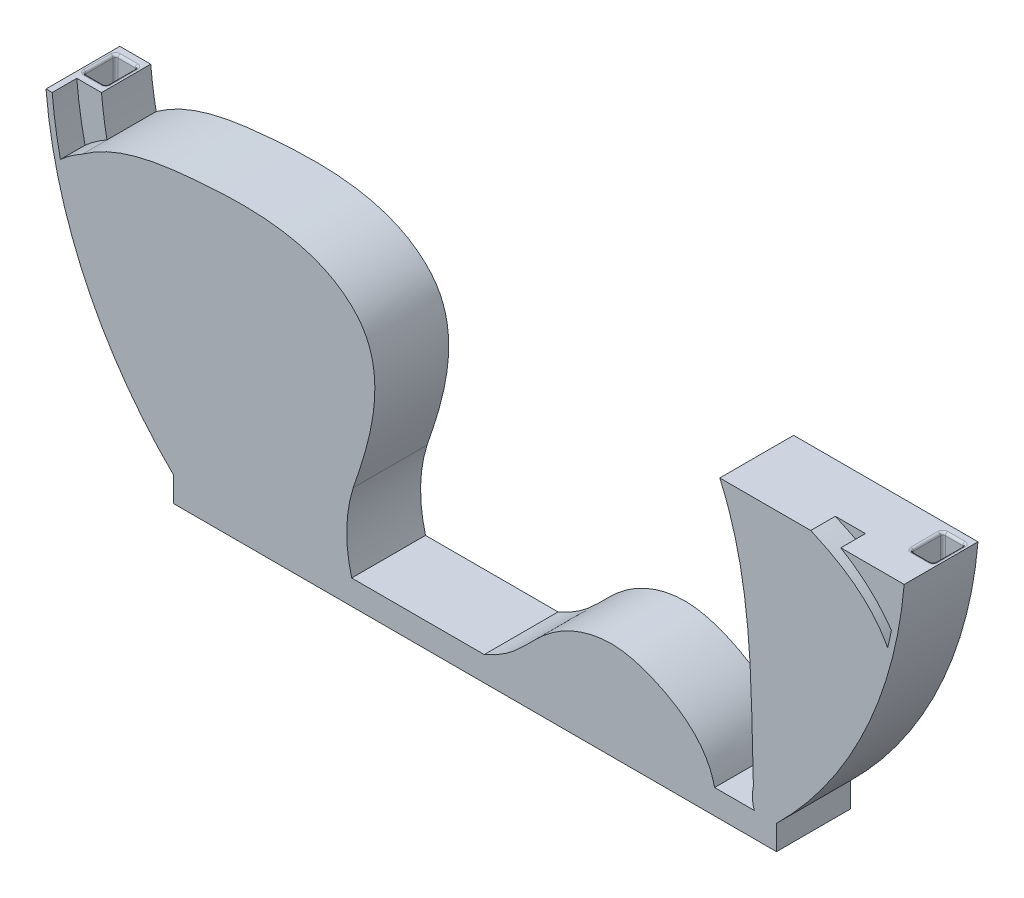
from build123d import *

# Parameters (mm, degrees)
SKETCH2_R           = 88.9
BOSS_EXTRUDE1_DEPTH = 7.62
CUT_EXTRUDE1_DEPTH  = 5.08
CUT_EXTRUDE2_DEPTH  = 5.08
SKETCH6_R           = 88.9
SKETCH6_R_2         = 87.63
BOSS_EXTRUDE2_DEPTH = 7.62
SKETCH5_W           = 447.85569709
SKETCH5_H           = 96.634651294
CUT_EXTRUDE3_DEPTH  = 132.443466321
CUT_EXTRUDE4_DEPTH  = 5.08
FILLET1_R           = 0.508
FILLET2_R           = 0.508
SKETCH8_W           = 235.469737428
SKETCH8_H           = 63.022782664
CUT_EXTRUDE6_DEPTH  = 30.48
SKETCH11_W          = 124.434078934
SKETCH11_H          = 15.24
BOSS_EXTRUDE3_DEPTH = 5.08
BOSS_EXTRUDE4_DEPTH = 5.08


with BuildPart() as part:
    # Sketch2 → Boss-Extrude1 (new, symmetric)
    with BuildSketch(Plane.XY):
        with Locations(Location((0, 0, 0), (0, 0, 180))):
            Circle(SKETCH2_R)
        with BuildLine():
            ThreePointArc((-82.315247566, -6.2211348), (-81.828164186, -10.892843798), (-81.076160162, -15.529286954))
            add(Edge.make_bspline(
                [(-81.076160162, -15.529286954), (-73.906972416, -10.329566502), (-59.046073895, -8.193381199), (-41.118812884, -7.621785306), (-29.401022662, -11.302114845), (-16.402067506, -22.130924736), (-22.534501322, -39.59705785), (-25.174662603, -47.236332112)],
                knots=[0, 0, 0, 0, 0.276571303, 0.483745751, 0.57530858, 0.672728071, 1, 1, 1, 1], degree=3))
            add(Edge.make_bspline(
                [(-25.174662603, -47.236332112), (-27.78260004, -55.688683624), (-25.255419914, -64.276124819)],
                knots=[0, 0, 0, 1, 1, 1], degree=2))
            add(Edge.make_bspline(
                [(-25.255419914, -64.276124819), (-19.568994185, -66.326395956), (-8.191864865, -67.179069199), (6.698062012, -62.452519029), (13.701149455, -53.656480208), (20.991800731, -49.374990358), (29.14906596, -47.7148715), (41.321609726, -51.605604), (49.118683791, -58.056687878), (49.804799161, -65.833004493)],
                knots=[0, 0, 0, 0, 0.203689327, 0.383928899, 0.501194003, 0.577509121, 0.667833303, 0.774874029, 1, 1, 1, 1], degree=3))
            ThreePointArc((49.804799161, -65.833004493), (53.727997634, -62.672200937), (57.451073953, -59.277960505))
            add(Edge.make_bspline(
                [(57.451073953, -59.277960505), (56.756918153, -39.692420945), (57.937164009, -17.253163459), (46.295557994, 0)],
                knots=[0, 0, 0, 0, 1, 1, 1, 1], degree=3))
            add(Edge.make_bspline(
                [(46.295557994, 0), (29.352418178, 2.160827537), (12.476860977, -1.829953153), (-4.097004325, -4.838743622)],
                knots=[0, 0, 0, 0, 1, 1, 1, 1], degree=3))
            add(Edge.make_bspline(
                [(-4.097004325, -4.838743622), (-9.003253572, -4.538646122), (-9.174496671, 2.827576235), (-6.823743398, 13.979544817), (0.460919685, 29.784330466), (13.972068662, 51.572454476), (27.394543454, 67.53561229), (37.735282985, 73.420371274)],
                knots=[0, 0, 0, 0, 0.104628163, 0.200082966, 0.362713634, 0.636377303, 1, 1, 1, 1], degree=3))
            ThreePointArc((37.735282985, 73.420371274), (31.253924322, 76.40480819), (24.539050502, 78.818383011))
            add(Edge.make_bspline(
                [(24.539050502, 78.818383011), (20.455603408, 74.411727836), (17.564971871, 65.824999318), (9.51286746, 57.448673309), (-6.264292968, 43.842012074), (-22.034432487, 67.881542589), (-34.946297284, 64.774058813)],
                knots=[0, 0, 0, 0, 0.241588619, 0.345090174, 0.475626468, 1, 1, 1, 1], degree=3))
            add(Edge.make_bspline(
                [(-34.946297284, 64.774058813), (-40.534107409, 56.654806295), (-49.826434679, 42.328020188), (-53.897482917, 22.922904088), (-55.122078377, 8.697330529), (-64.97763294, -2.490084084), (-73.627608697, -8.872135806), (-82.315247566, -6.2211348)],
                knots=[0, 0, 0, 0, 0.32342158, 0.539679085, 0.642017351, 0.776511597, 1, 1, 1, 1], degree=3))
        make_face(mode=Mode.SUBTRACT)
    extrude(amount=BOSS_EXTRUDE1_DEPTH, both=True)

    # Sketch3 → Cut-Extrude1 (cut)
    with BuildSketch(Plane.XY.offset(7.62)):
        with BuildLine():
            ThreePointArc((45.031224335, -76.651150251), (52.423489091, -71.798243652), (59.297063103, -66.23494778))
            add(Edge.make_bspline(
                [(57.451073953, -59.277960505), (56.590081261, -63.222807516), (59.297063103, -66.23494778)],
                knots=[0, 0, 0, 1, 1, 1], degree=2))
            ThreePointArc((57.451073953, -59.277960505), (53.727997634, -62.672200937), (49.804799161, -65.833004493))
            add(Edge.make_bspline(
                [(49.804799161, -65.833004493), (50.290836256, -72.182369469), (45.031224335, -76.651150251)],
                knots=[0, 0, 0, 1, 1, 1], degree=2))
        make_face()
        with BuildLine():
            ThreePointArc((-88.68252483, 6.214482268), (-88.635767577, -6.849139077), (-86.675026694, -19.764861438))
            add(Edge.make_bspline(
                [(-81.076160162, -15.529286954), (-84.185623479, -17.238401337), (-86.675026694, -19.764861438)],
                knots=[0, 0, 0, 1, 1, 1], degree=2))
            ThreePointArc((-81.076160162, -15.529286954), (-81.828164186, -10.892843798), (-82.315247566, -6.2211348))
            add(Edge.make_bspline(
                [(-82.315247566, -6.2211348), (-88.132024584, -1.499163565), (-88.68252483, 6.214482268)],
                knots=[0, 0, 0, 1, 1, 1], degree=2))
        make_face()
        with BuildLine():
            ThreePointArc((46.295557994, 75.894211308), (38.302929005, 80.22528049), (29.909783679, 83.717470341))
            add(Edge.make_bspline(
                [(24.539050502, 78.818383011), (26.687958515, 81.902861564), (29.909783679, 83.717470341)],
                knots=[0, 0, 0, 1, 1, 1], degree=2))
            ThreePointArc((24.539050502, 78.818383011), (31.253924322, 76.40480819), (37.735282985, 73.420371274))
            add(Edge.make_bspline(
                [(37.735282985, 73.420371274), (41.692258874, 75.781578849), (46.295557994, 75.894211308)],
                knots=[0, 0, 0, 1, 1, 1], degree=2))
        make_face()
    extrude(amount=-CUT_EXTRUDE1_DEPTH, mode=Mode.SUBTRACT)

    # Sketch4 → Cut-Extrude2 (cut)
    with BuildSketch(Plane.XY.offset(7.62)):
        with BuildLine():
            add(Edge.make_bspline(
                [(47.900635375, -2.546062133), (47.394653083, -1.68578683), (46.860186189, -0.836793698), (46.295557994, 0)],
                knots=[0.951499115, 0.951499115, 0.951499115, 0.951499115, 1, 1, 1, 1], degree=3))
            add(Edge.make_bspline(
                [(46.295557994, 0), (53.13831993, -0.121479856), (68.560923547, -2.55317749), (82.330777435, -11.060245422), (86.920742606, -18.654610819)],
                knots=[0, 0, 0, 0, 0.442007256, 1, 1, 1, 1], degree=3))
            ThreePointArc((86.920742606, -18.654610819), (86.48950366, -20.561511535), (86.016435709, -22.458468066))
            add(Edge.make_bspline(
                [(47.900635375, -2.546062133), (54.105200197, -2.383601891), (68.545991377, -6.411725997), (82.278778054, -13.661239618), (86.016435709, -22.458468066)],
                knots=[0, 0, 0, 0, 0.409341375, 1, 1, 1, 1], degree=3))
        make_face()
        with BuildLine():
            add(Edge.make_bspline(
                [(-25.255419914, -64.276124819), (-24.329796264, -64.609863365), (-23.39490974, -64.901263139), (-22.452232953, -65.15178529)],
                knots=[0, 0, 0, 0, 0.033156093, 0.033156093, 0.033156093, 0.033156093], degree=3))
            add(Edge.make_bspline(
                [(-22.452232953, -65.15178529), (-17.435167734, -76.286545317), (-6.016270367, -83.097855064), (4.238511489, -88.798902135)],
                knots=[0, 0, 0, 0, 1, 1, 1, 1], degree=3))
            ThreePointArc((4.238511489, -88.798902135), (2.435652007, -88.866628153), (0.631789417, -88.897754989))
            add(Edge.make_bspline(
                [(-25.255419914, -64.276124819), (-21.127783836, -75.858222766), (-10.467359196, -84.393639797), (0.631789417, -88.897754989)],
                knots=[0, 0, 0, 0, 1, 1, 1, 1], degree=3))
        make_face()
        with BuildLine():
            add(Edge.make_bspline(
                [(-34.946297284, 64.774058813), (-50.35182607, 67.382365169), (-64.84460315, 60.814368716)],
                knots=[0, 0, 0, 1, 1, 1], degree=2))
            ThreePointArc((-64.84460315, 60.814368716), (-66.672342804, 58.804835729), (-68.43783363, 56.740399435))
            add(Edge.make_bspline(
                [(-35.097283324, 62.444599517), (-52.424851341, 65.607841777), (-68.43783363, 56.740399435)],
                knots=[0, 0, 0, 1, 1, 1], degree=2))
            Line((-35.097283324, 62.444599517), (-34.946297284, 64.774058813))
        make_face()
    extrude(amount=-CUT_EXTRUDE2_DEPTH, mode=Mode.SUBTRACT)

    # Sketch6 → Boss-Extrude2 (add, symmetric)
    with BuildSketch(Plane.XY):
        with Locations(Location((0, 0, 0), (0, 0, 180))):
            Circle(SKETCH6_R)
        Circle(SKETCH6_R_2, mode=Mode.SUBTRACT)
    extrude(amount=BOSS_EXTRUDE2_DEPTH, both=True)

    # Sketch5 → Cut-Extrude3 (cut, through all)
    with BuildSketch(Plane(origin=(0, -7.62, 0), x_dir=(1, 0, 0), z_dir=(0, 1, 0))):
        Rectangle(SKETCH5_W, SKETCH5_H)
    extrude(amount=CUT_EXTRUDE3_DEPTH, mode=Mode.SUBTRACT)

    # Sketch7 → Cut-Extrude4 (cut)
    with BuildSketch(Plane(origin=(0, -7.62, 0), x_dir=(1, 0, 0), z_dir=(0, 1, 0))):
        with BuildLine():
            Line((-87.163190925, 5.842), (-83.607190925, 5.842))
            ThreePointArc((-83.607190925, 5.842), (-83.24798068, 5.693210245), (-83.099190925, 5.334))
            Line((-83.099190925, 5.334), (-83.099190925, -0.254))
            ThreePointArc((-83.099190925, -0.254), (-83.24798068, -0.613210245), (-83.607190925, -0.762))
            Line((-83.607190925, -0.762), (-87.163190925, -0.762))
            ThreePointArc((-87.163190925, -0.762), (-87.522401169, -0.613210245), (-87.671190925, -0.254))
            Line((-87.671190925, -0.254), (-87.671190925, 5.334))
            ThreePointArc((-87.671190925, 5.334), (-87.522401169, 5.693210245), (-87.163190925, 5.842))
        make_face()
        with BuildLine():
            Line((87.163190925, -0.762), (83.607190925, -0.762))
            ThreePointArc((83.607190925, -0.762), (83.24798068, -0.613210245), (83.099190925, -0.254))
            Line((83.099190925, -0.254), (83.099190925, 5.334))
            ThreePointArc((83.099190925, 5.334), (83.24798068, 5.693210245), (83.607190925, 5.842))
            Line((83.607190925, 5.842), (87.163190925, 5.842))
            ThreePointArc((87.163190925, 5.842), (87.522401169, 5.693210245), (87.671190925, 5.334))
            Line((87.671190925, 5.334), (87.671190925, -0.254))
            ThreePointArc((87.671190925, -0.254), (87.522401169, -0.613210245), (87.163190925, -0.762))
        make_face()
    extrude(amount=-CUT_EXTRUDE4_DEPTH, mode=Mode.SUBTRACT)

    # Fillet1
    fillet1_edges = [part.edges().sort_by_distance(p)[0] for p in [
        (-87.522401169, -7.62, 0.613210245),
        (-85.385190925, -7.62, 0.762),
        (-83.24798068, -7.62, 0.613210245),
        (-83.099190925, -7.62, -2.54),
        (-83.24798068, -7.62, -5.693210245),
        (-85.385190925, -7.62, -5.842),
        (-87.522401169, -7.62, -5.693210245),
        (-87.671190925, -7.62, -2.54),
    ]]
    fillet(fillet1_edges, radius=FILLET1_R)

    # Fillet2
    fillet2_edges = [part.edges().sort_by_distance(p)[0] for p in [
        (87.522401169, -7.62, 0.613210245),
        (87.671190925, -7.62, -2.54),
        (87.522401169, -7.62, -5.693210245),
        (85.385190925, -7.62, -5.842),
        (83.24798068, -7.62, -5.693210245),
        (83.099190925, -7.62, -2.54),
        (83.24798068, -7.62, 0.613210245),
        (85.385190925, -7.62, 0.762),
    ]]
    fillet(fillet2_edges, radius=FILLET2_R)

    # Sketch8 → Cut-Extrude6 (cut)
    with BuildSketch(Plane(origin=(0, -63.5, 0), x_dir=(-1, 0, 0), z_dir=(0, -1, 0))):
        with Locations((12.697642911, -4.339889392)):
            Rectangle(SKETCH8_W, SKETCH8_H)
    extrude(amount=CUT_EXTRUDE6_DEPTH, mode=Mode.SUBTRACT)


with BuildPart() as cut_extrude6_piece_1:
    # of the separate pieces the step leaves, piece 1, a body of its own (cut_extrude6_pieces)
    add(part.part.solids().sort_by_distance((-88.572826533, -7.62, -7.62))[0])



with BuildPart() as cut_extrude6_piece_2:
    # of the separate pieces the step leaves, piece 2, a body of its own (cut_extrude6_pieces)
    add(part.part.solids().sort_by_distance((88.179190925, -7.62, 0.254))[0])


with BuildPart() as cut_extrude6_piece_3:
    # of the separate pieces the step leaves, piece 3, a body of its own (cut_extrude6_pieces)
    add(part.part.solids().sort_by_distance((1.891173644, -63.5, -7.62))[0])


with BuildPart() as cut_extrude6_piece_1_1:
    add(cut_extrude6_piece_1.part)

    add(cut_extrude6_piece_2.part)  # Boss-Extrude3 merges Cut-Extrude6 piece 2

    add(cut_extrude6_piece_3.part)  # Boss-Extrude3 merges Cut-Extrude6 piece 3
    # Sketch11 → Boss-Extrude3 (add)
    with BuildSketch(Plane(origin=(0, -63.5, 0), x_dir=(-1, 0, 0), z_dir=(0, -1, 0))):
        Rectangle(SKETCH11_W, SKETCH11_H)
    extrude(amount=BOSS_EXTRUDE3_DEPTH)

    # Sketch12 → Boss-Extrude4 (add)
    with BuildSketch(Plane.XZ.offset(68.58)):
        with BuildLine():
            Line((-4.318, 2.54), (4.318, 2.54))
            ThreePointArc((4.318, 2.54), (4.856815367, 2.316815367), (5.08, 1.778))
            Line((5.08, 1.778), (5.08, -1.778))
            ThreePointArc((5.08, -1.778), (4.856815367, -2.316815367), (4.318, -2.54))
            Line((4.318, -2.54), (-4.318, -2.54))
            ThreePointArc((-4.318, -2.54), (-4.856815367, -2.316815367), (-5.08, -1.778))
            Line((-5.08, -1.778), (-5.08, 1.778))
            ThreePointArc((-5.08, 1.778), (-4.856815367, 2.316815367), (-4.318, 2.54))
        make_face()
    extrude(amount=BOSS_EXTRUDE4_DEPTH)


solid = cut_extrude6_piece_1_1.part
